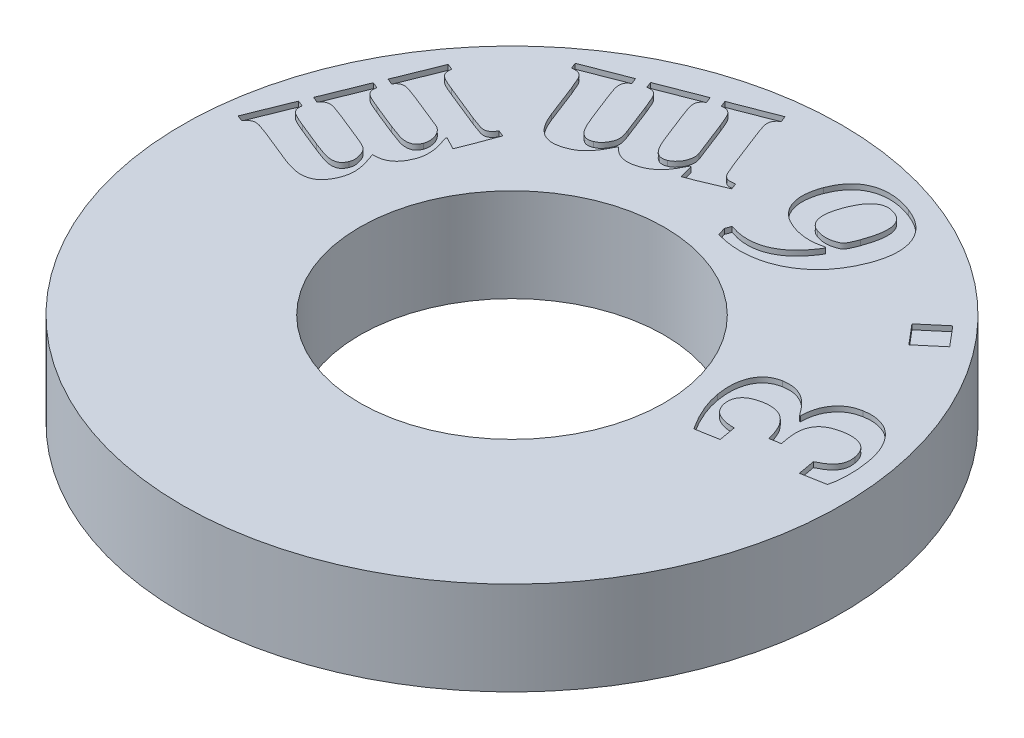
from build123d import *

# Parameters (mm, degrees)
SKETCH1_R           = 12.7
BOSS_EXTRUDE1_DEPTH = 3.6
SKETCH2_R           = 5.8674
CUT_EXTRUDE1_DEPTH  = 19.317750954
CUT_EXTRUDE2_DEPTH  = 0.2


with BuildPart() as part:
    # Sketch1 → Boss-Extrude1 (new body)
    with BuildSketch(Plane(origin=(0, 0, 0), x_dir=(1, 0, 0), z_dir=(0, 1, 0))):
        with Locations(Location((0, 0, 0), (0, 0, 270))):
            Circle(SKETCH1_R)
    extrude(amount=BOSS_EXTRUDE1_DEPTH)

    # Sketch2 → Cut-Extrude1 (cut, through all)
    with BuildSketch(Plane(origin=(0, 0, 0), x_dir=(-1, 0, 0), z_dir=(0, -1, 0))):
        with Locations(Location((0, 0, 0), (0, 0, 90))):
            Circle(SKETCH2_R)
    extrude(amount=-CUT_EXTRUDE1_DEPTH, mode=Mode.SUBTRACT)

    # Sketch4 → Cut-Extrude2 (cut)
    # profile 1 of 5: a face of its own
    with BuildSketch(Plane(origin=(0, 3.6, 0), x_dir=(1, 0, 0), z_dir=(0, 1, 0))):
        with BuildLine():
            Line((8.164580493, -0.141111111), (7.299172507, -0.294348958))
            add(Edge.make_bspline(
                [(7.299172507, -0.294348958), (7.254126865, -0.224151115), (7.165775959, -0.086467583), (7.045489583, 0.122458288), (6.938429156, 0.327907963), (6.845588657, 0.530877084), (6.764550442, 0.729493953), (6.698650802, 0.925985441), (6.643082808, 1.118355277), (6.618049918, 1.247367299), (6.605743687, 1.310789931)],
                knots=[0, 0, 0, 0, 1.137107975, 2.23028277, 3.285789175, 4.29468346, 5.272556553, 6.20897527, 7.119527785, 8, 8, 8, 8], degree=3))
            add(Edge.make_bspline(
                [(6.605743687, 1.310789931), (6.594270562, 1.38377459), (6.571928431, 1.525900877), (6.558947636, 1.736162087), (6.562833216, 1.936093162), (6.58410888, 2.125025368), (6.624243067, 2.300223785), (6.682765182, 2.45978553), (6.758962892, 2.602442887), (6.853390282, 2.727545195), (6.965656947, 2.833485564), (7.09561771, 2.918642555), (7.242991414, 2.981053957), (7.348665157, 3.004327267), (7.402800979, 3.01625)],
                knots=[0, 0, 0, 0, 1.257534887, 2.448853862, 3.581761746, 4.659110775, 5.680658369, 6.634983106, 7.544925383, 8.424762642, 9.292432414, 10.160237565, 11.057504272, 12, 12, 12, 12], degree=3))
            add(Edge.make_bspline(
                [(7.402800979, 3.01625), (7.453401354, 3.02362584), (7.551680605, 3.037951664), (7.69794884, 3.040231883), (7.837573421, 3.024901552), (7.971110699, 2.992446158), (8.098362087, 2.944895478), (8.219666965, 2.882100332), (8.335895968, 2.805882639), (8.447266456, 2.713606621), (8.556444324, 2.606194026), (8.668901434, 2.484744861), (8.780212806, 2.344232093), (8.853239027, 2.243719149), (8.891082229, 2.191631944)],
                knots=[0, 0, 0, 0, 1.013739218, 1.968948484, 2.893245571, 3.793330219, 4.688470041, 5.581915844, 6.497952119, 7.440811012, 8.446231258, 9.53500789, 10.72260683, 12, 12, 12, 12], degree=3))
            Line((8.891082229, 2.191631944), (8.924155146, 2.198246528))
            add(Edge.make_bspline(
                [(8.924155146, 2.198246528), (8.924918634, 2.251967384), (8.926430196, 2.358324536), (8.947473771, 2.515402809), (8.979674955, 2.668205104), (9.028264793, 2.815080237), (9.091963081, 2.953896093), (9.170838403, 3.083595629), (9.266021551, 3.201490829), (9.375901049, 3.308259942), (9.500439904, 3.401525353), (9.641028101, 3.476619078), (9.795253083, 3.534806257), (9.904558779, 3.557876025), (9.960439868, 3.569670139)],
                knots=[0, 0, 0, 0, 1.026335185, 2.031949896, 3.024124183, 4.008331677, 4.982837344, 5.938341286, 6.902791705, 7.871633439, 8.860843291, 9.866752457, 10.909405448, 12, 12, 12, 12], degree=3))
            add(Edge.make_bspline(
                [(9.960439868, 3.569670139), (10.02973183, 3.579810447), (10.165317884, 3.59965235), (10.368599346, 3.594073048), (10.564481426, 3.562117282), (10.721811743, 3.512715037), (10.841751206, 3.458209336), (10.929302634, 3.411216165), (11.012460066, 3.355066353), (11.093066227, 3.292408771), (11.170330286, 3.221492934), (11.244348579, 3.142988141), (11.31460909, 3.056826737), (11.382174158, 2.963848054), (11.446012474, 2.864003809), (11.504277471, 2.757036048), (11.557126893, 2.64330511), (11.607411674, 2.523988889), (11.649279477, 2.396241197), (11.689640871, 2.263161114), (11.723823342, 2.122933348), (11.741692043, 2.026728187), (11.75078709, 1.977760417)],
                knots=[0, 0, 0, 0, 1.552055264, 3.036961932, 4.491926841, 5.946868886, 6.680668832, 7.414332759, 8.149582009, 8.905049753, 9.678705273, 10.474991778, 11.297986015, 12.144768462, 13.024991339, 13.926610153, 14.846130849, 15.808017766, 16.798530401, 17.828267102, 18.894602771, 20, 20, 20, 20], degree=3))
            add(Edge.make_bspline(
                [(11.75078709, 1.977760417), (11.762170129, 1.909141634), (11.784865898, 1.772327898), (11.805834162, 1.566157462), (11.820237717, 1.360255663), (11.821432039, 1.156401104), (11.815751139, 0.958057912), (11.799090489, 0.769266598), (11.773822813, 0.591512389), (11.74718336, 0.478296539), (11.734250632, 0.423333333)],
                knots=[0, 0, 0, 0, 1.066248548, 2.125911334, 3.176109364, 4.22982333, 5.250230149, 6.217431478, 7.134611624, 8, 8, 8, 8], degree=3))
            Line((11.734250632, 0.423333333), (10.81702841, 0.260173611))
            Line((10.81702841, 0.260173611), (10.700170771, 0.917222222))
            add(Edge.make_bspline(
                [(10.700170771, 0.917222222), (10.762179027, 0.947249342), (10.87880441, 1.003724473), (11.034174858, 1.101751404), (11.158720401, 1.206462209), (11.253775922, 1.319041601), (11.319999677, 1.441297519), (11.357555629, 1.573998106), (11.369098331, 1.717631478), (11.355492256, 1.8147095), (11.348399937, 1.8653125)],
                knots=[0, 0, 0, 0, 1.315010116, 2.473276457, 3.498567572, 4.410559322, 5.270838744, 6.132605253, 7.026599701, 8, 8, 8, 8], degree=3))
            add(Edge.make_bspline(
                [(11.348399937, 1.8653125), (11.341875398, 1.896288119), (11.329168234, 1.956616093), (11.303022935, 2.042880304), (11.269570612, 2.121812102), (11.230594454, 2.193837832), (11.183135666, 2.256957094), (11.131530054, 2.314555266), (11.071096113, 2.362472217), (11.00586727, 2.405220266), (10.933755742, 2.439162109), (10.855303799, 2.465778349), (10.770761853, 2.485449867), (10.67922078, 2.497494268), (10.581482565, 2.501671969), (10.477666576, 2.497756593), (10.36751511, 2.48816074), (10.292571495, 2.47583813), (10.253686396, 2.469444444)],
                knots=[0, 0, 0, 0, 1.062681572, 2.069673814, 3.020757619, 3.937606762, 4.811257529, 5.667036378, 6.526543355, 7.392491981, 8.281089848, 9.194194867, 10.169932879, 11.190815326, 12.290117787, 13.450598505, 14.67722244, 16, 16, 16, 16], degree=3))
            add(Edge.make_bspline(
                [(10.253686396, 2.469444444), (10.21236047, 2.46132416), (10.131880827, 2.445510415), (10.017411818, 2.410878653), (9.912269196, 2.370828699), (9.817507825, 2.322327855), (9.730958567, 2.269412482), (9.655575618, 2.206825721), (9.589554436, 2.137741036), (9.533205575, 2.061467789), (9.486328214, 1.977858623), (9.449830602, 1.88666702), (9.423879767, 1.788072069), (9.406187836, 1.682170703), (9.397512474, 1.568922063), (9.398928891, 1.448354811), (9.410343924, 1.320580603), (9.424126681, 1.23354771), (9.431273201, 1.188420139)],
                knots=[0, 0, 0, 0, 1.154959404, 2.249210876, 3.277206245, 4.237710271, 5.166517796, 6.054758483, 6.917744217, 7.78290676, 8.649654335, 9.540923156, 10.470387237, 11.441785199, 12.483486141, 13.582604788, 14.746552339, 16, 16, 16, 16], degree=3))
            Line((9.431273201, 1.188420139), (9.481985007, 0.900685764))
            Line((9.481985007, 0.900685764), (9.065266257, 0.826822917))
            add(Edge.make_bspline(
                [(9.065266257, 0.826822917), (9.053323817, 0.877676496), (9.030137799, 0.976407744), (8.987244973, 1.117988979), (8.937533381, 1.248770458), (8.881792532, 1.368690848), (8.819830871, 1.477481839), (8.752229286, 1.575466019), (8.678817317, 1.662719018), (8.598729466, 1.738292833), (8.513214815, 1.803047835), (8.421509279, 1.856340144), (8.323475539, 1.896941453), (8.220208249, 1.927841187), (8.110287748, 1.942901187), (7.995250364, 1.950152445), (7.874369093, 1.944561747), (7.792962145, 1.931532679), (7.751169035, 1.92484375)],
                knots=[0, 0, 0, 0, 1.29334587, 2.511006204, 3.66023295, 4.755331661, 5.78245763, 6.75683239, 7.69945718, 8.600673867, 9.477910914, 10.350415315, 11.219115034, 12.100354848, 13.011532052, 13.959500513, 14.952438064, 16, 16, 16, 16], degree=3))
            add(Edge.make_bspline(
                [(7.751169035, 1.92484375), (7.718361479, 1.918684397), (7.654878827, 1.906766043), (7.56449535, 1.882070779), (7.481027571, 1.854805546), (7.404677013, 1.822802045), (7.334829516, 1.786487271), (7.272164335, 1.74578084), (7.216101005, 1.701748524), (7.168731337, 1.652587746), (7.127375298, 1.600945568), (7.093993557, 1.544819854), (7.06728175, 1.485362703), (7.048847784, 1.421835625), (7.036374118, 1.355396311), (7.032194914, 1.285454635), (7.035753428, 1.211992754), (7.042982253, 1.16228153), (7.04671591, 1.136605903)],
                knots=[0, 0, 0, 0, 1.330790509, 2.575080919, 3.733736543, 4.830684231, 5.873010726, 6.868969425, 7.807408956, 8.709078305, 9.585745051, 10.440327213, 11.306394197, 12.178146853, 13.072160606, 13.997345489, 14.965637813, 16, 16, 16, 16], degree=3))
            add(Edge.make_bspline(
                [(7.04671591, 1.136605903), (7.053004764, 1.107385859), (7.065390456, 1.04983794), (7.095730836, 0.96773557), (7.134678797, 0.890623747), (7.18316375, 0.818478839), (7.243733132, 0.751860879), (7.318753902, 0.693659581), (7.406941065, 0.641629631), (7.508842162, 0.596349572), (7.624681245, 0.560613729), (7.753820566, 0.534008848), (7.896341682, 0.519118617), (7.995874441, 0.51702704), (8.047722854, 0.5159375)],
                knots=[0, 0, 0, 0, 0.831011314, 1.636649549, 2.42794293, 3.230719671, 4.048727296, 4.922444941, 5.862595765, 6.892733277, 8.018408123, 9.229923594, 10.557017127, 12, 12, 12, 12], degree=3))
            Line((8.047722854, 0.5159375), (8.164580493, -0.141111111))
        make_face()
    # profile 2 of 5: a face of its own
    with BuildSketch(Plane(origin=(0, 3.6, 0), x_dir=(1, 0, 0), z_dir=(0, 1, 0))):
        Polygon((7.998334498, 7.413598887), (8.851615748, 8.134588471), (9.493230331, 7.375013818), (8.639949081, 6.654024235), align=None)
    # profile 3 of 5: a face of its own
    with BuildSketch(Plane(origin=(0, 3.6, 0), x_dir=(1, 0, 0), z_dir=(0, 1, 0))):
        with BuildLine():
            Line((1.200452366, 6.983777969), (1.280929797, 7.199854358))
            add(Edge.make_bspline(
                [(1.280929797, 7.199854358), (1.343817795, 7.179261353), (1.467155686, 7.138873713), (1.654011169, 7.098413309), (1.836977253, 7.07493453), (2.015597423, 7.068035969), (2.190562747, 7.078072145), (2.361694864, 7.104178741), (2.529159758, 7.148459834), (2.691452106, 7.211129672), (2.849876645, 7.288087424), (3.00262888, 7.382899312), (3.150358517, 7.492976917), (3.291751018, 7.620066885), (3.42880272, 7.760899591), (3.558935253, 7.919039208), (3.685331048, 8.091932582), (3.761884595, 8.216465585), (3.801086047, 8.280236302)],
                knots=[0, 0, 0, 0, 1.055048788, 2.0691944, 3.044229261, 3.994526873, 4.916374231, 5.835814113, 6.751508959, 7.673635849, 8.606948974, 9.557047682, 10.537179467, 11.541963796, 12.586653235, 13.668953384, 14.806320344, 16, 16, 16, 16], degree=3))
            Line((3.801086047, 8.280236302), (3.770217991, 8.307797066))
            add(Edge.make_bspline(
                [(3.770217991, 8.307797066), (3.71414798, 8.294562398), (3.604496336, 8.268680414), (3.440218512, 8.243045281), (3.280238818, 8.230703616), (3.12312468, 8.231653016), (2.966792107, 8.24638583), (2.809094217, 8.274242223), (2.648638057, 8.314787763), (2.542955388, 8.351804744), (2.489193686, 8.370635608)],
                knots=[0, 0, 0, 0, 1.05963004, 2.072233846, 3.055361679, 4.0086536, 4.959232627, 5.940685308, 6.95240852, 8, 8, 8, 8], degree=3))
            add(Edge.make_bspline(
                [(2.489193686, 8.370635608), (2.425678851, 8.396737335), (2.302249784, 8.447461105), (2.132920474, 8.545831273), (1.986886121, 8.662813599), (1.863257967, 8.795473288), (1.764751057, 8.943805026), (1.688468588, 9.103519705), (1.639308535, 9.275732636), (1.612688242, 9.457753868), (1.611225732, 9.648604645), (1.633351871, 9.846131474), (1.675600618, 10.050562667), (1.722178032, 10.185318726), (1.746155491, 10.254689427)],
                knots=[0, 0, 0, 0, 1.077595584, 2.094103196, 3.062986482, 4.006354381, 4.929902502, 5.848931818, 6.774838988, 7.731371815, 8.729829957, 9.762912156, 10.848375697, 12, 12, 12, 12], degree=3))
            add(Edge.make_bspline(
                [(1.746155491, 10.254689427), (1.7763527, 10.329017713), (1.835212514, 10.473896968), (1.951299256, 10.672660048), (2.085665588, 10.848945539), (2.213804547, 10.97741434), (2.326332688, 11.065860187), (2.414590439, 11.126148678), (2.508811454, 11.177493313), (2.606907441, 11.223070875), (2.710126865, 11.260830416), (2.818355474, 11.290046763), (2.930920772, 11.313549546), (3.048111242, 11.328816613), (3.169265694, 11.336319095), (3.294130713, 11.336644782), (3.422555278, 11.327106532), (3.55443731, 11.311041992), (3.689828281, 11.285147679), (3.828062677, 11.250881114), (3.970010998, 11.208775039), (4.064699677, 11.175620405), (4.113073894, 11.158682483)],
                knots=[0, 0, 0, 0, 1.672877526, 3.260740491, 4.787171376, 6.289516588, 7.032212332, 7.772527889, 8.517517252, 9.269110702, 10.028607479, 10.808285605, 11.607046719, 12.427139982, 13.272559756, 14.139283271, 15.03113053, 15.958707747, 16.910946222, 17.906201506, 18.93032764, 20, 20, 20, 20], degree=3))
            add(Edge.make_bspline(
                [(4.113073894, 11.158682483), (4.15697111, 11.141450954), (4.243422618, 11.107515052), (4.368170705, 11.050419534), (4.484996173, 10.987386071), (4.59493391, 10.920003123), (4.697245283, 10.847353308), (4.79277647, 10.769806838), (4.880831456, 10.687287685), (4.961582993, 10.600024174), (5.034609675, 10.508303615), (5.099779246, 10.41208411), (5.157520331, 10.31176066), (5.205939239, 10.20638206), (5.246771826, 10.09693552), (5.280219809, 9.983207721), (5.303980564, 9.864730901), (5.320880501, 9.742517717), (5.328043678, 9.616488704), (5.328305305, 9.48689334), (5.319416583, 9.353933132), (5.301199014, 9.21787529), (5.276088854, 9.078654194), (5.241524935, 8.936320611), (5.198718022, 8.790527437), (5.163826853, 8.693479882), (5.146051325, 8.644038385)],
                knots=[0, 0, 0, 0, 1.098191461, 2.162786548, 3.192832132, 4.188048845, 5.164054587, 6.113082797, 7.051594597, 7.972179555, 8.879742853, 9.779402692, 10.67641257, 11.572442019, 12.476973698, 13.395128669, 14.330043427, 15.288670823, 16.266176383, 17.267519822, 18.30535816, 19.36692158, 20.463110258, 21.598586896, 22.776584751, 24, 24, 24, 24], degree=3))
            add(Edge.make_bspline(
                [(5.146051325, 8.644038385), (5.120410458, 8.577547881), (5.069504659, 8.445541726), (4.979642143, 8.255748764), (4.882591907, 8.073477), (4.7757546, 7.901071263), (4.66050112, 7.736651354), (4.536347737, 7.581334242), (4.401952184, 7.435476143), (4.260695193, 7.298015339), (4.111468893, 7.171081941), (3.956153925, 7.054726669), (3.793202875, 6.951568523), (3.625965791, 6.857262903), (3.452169721, 6.775166977), (3.271848517, 6.706482366), (3.086418619, 6.645984938), (2.895066533, 6.599208672), (2.700286371, 6.564048118), (2.50372428, 6.540540621), (2.305560774, 6.530620344), (2.106360141, 6.534210416), (1.905755587, 6.549850704), (1.704278713, 6.57711169), (1.501495309, 6.618153508), (1.367468793, 6.65450437), (1.299671116, 6.672892552)],
                knots=[0, 0, 0, 0, 1.070823632, 2.125947334, 3.153976389, 4.173332704, 5.172465224, 6.170528418, 7.159609897, 8.15178657, 9.131336938, 10.102378564, 11.066150857, 12.028085339, 12.986779263, 13.952022445, 14.926733186, 15.916739616, 16.91025301, 17.90025944, 18.890219644, 19.890115268, 20.892859756, 21.913053768, 22.944312598, 24, 24, 24, 24], degree=3))
            Line((1.299671116, 6.672892552), (1.200452366, 6.983777969))
        make_face()
        with BuildLine():
            add(Edge.make_bspline(
                [(3.076789172, 8.698057483), (3.132909456, 8.679932439), (3.243010075, 8.644373488), (3.413032857, 8.625283629), (3.576075832, 8.63331494), (3.704133547, 8.658205157), (3.795432605, 8.686357261), (3.852529709, 8.707316756), (3.898519111, 8.728016151), (3.948692476, 8.75488002), (4.001805532, 8.805818747), (4.047266948, 8.872729684), (4.084461884, 8.946478634), (4.119923668, 9.023856133), (4.158569665, 9.121872517), (4.186258552, 9.19376456), (4.201268339, 9.232736302)],
                knots=[0, 0, 0, 0, 1.710541778, 3.355858038, 4.938271646, 6.440062148, 7.13262002, 7.713873542, 8.206199276, 8.598318393, 9.361997601, 10.313061428, 10.938824559, 11.760841173, 12.786181087, 14, 14, 14, 14], degree=3))
            add(Edge.make_bspline(
                [(4.201268339, 9.232736302), (4.219616657, 9.284432015), (4.255072374, 9.384327197), (4.30105685, 9.531510269), (4.335960436, 9.671161482), (4.362974871, 9.803145166), (4.381080853, 9.927152769), (4.388903885, 10.043638718), (4.388039482, 10.152006568), (4.378848483, 10.252989558), (4.358648581, 10.346021304), (4.330820471, 10.43180026), (4.290949714, 10.508625418), (4.24422561, 10.579514316), (4.184064175, 10.639885789), (4.116891173, 10.694879513), (4.038769365, 10.7401109), (3.982187335, 10.763211055), (3.953221464, 10.775036649)],
                knots=[0, 0, 0, 0, 1.500894568, 2.900281813, 4.217152542, 5.437764563, 6.585289063, 7.643385764, 8.628806701, 9.548256839, 10.412033135, 11.229197673, 12.007129352, 12.774066827, 13.542058149, 14.328777375, 15.144455933, 16, 16, 16, 16], degree=3))
            add(Edge.make_bspline(
                [(3.953221464, 10.775036649), (3.919245977, 10.786364872), (3.853943728, 10.80813817), (3.75608292, 10.828911875), (3.662442482, 10.834694319), (3.573482634, 10.826592591), (3.488865702, 10.807977138), (3.408458099, 10.777657234), (3.332269753, 10.736631897), (3.260047544, 10.685155263), (3.191439608, 10.624053207), (3.126309215, 10.552989981), (3.064446481, 10.472120724), (2.985796284, 10.348662157), (2.892809985, 10.174619164), (2.834135004, 10.024617309), (2.803386394, 9.946008871)],
                knots=[0, 0, 0, 0, 0.932873925, 1.793021151, 2.598839487, 3.367856657, 4.113627244, 4.849993345, 5.599749579, 6.36230028, 7.155964143, 7.989527263, 8.87058289, 9.805567893, 11.801908814, 14, 14, 14, 14], degree=3))
            add(Edge.make_bspline(
                [(2.803386394, 9.946008871), (2.789021343, 9.905717802), (2.761142699, 9.82752383), (2.727163126, 9.711565588), (2.69985937, 9.601384176), (2.682829992, 9.496212874), (2.670852833, 9.39695612), (2.668292805, 9.303160591), (2.675472645, 9.215066626), (2.688060026, 9.132630092), (2.708521729, 9.055609287), (2.739278462, 8.985918652), (2.775041981, 8.920834938), (2.820963864, 8.863655968), (2.873499986, 8.812178352), (2.933526127, 8.766434912), (3.002012742, 8.728007435), (3.051553194, 8.708165164), (3.076789172, 8.698057483)],
                knots=[0, 0, 0, 0, 1.424088551, 2.763767271, 4.022183305, 5.201039714, 6.30911801, 7.349523498, 8.319005133, 9.248428938, 10.124185317, 10.962911168, 11.779474492, 12.589779123, 13.394520957, 14.224182145, 15.095395788, 16, 16, 16, 16], degree=3))
        make_face(mode=Mode.SUBTRACT)
    # profile 4 of 5: a face of its own
    with BuildSketch(Plane(origin=(0, 3.6, 0), x_dir=(1, 0, 0), z_dir=(0, 1, 0))):
        with BuildLine():
            Line((-1.500499582, 8.398806621), (-1.545699235, 8.394396899))
            add(Edge.make_bspline(
                [(-1.545699235, 8.394396899), (-1.578680129, 8.328177935), (-1.64156419, 8.201919461), (-1.744030648, 8.02884167), (-1.846044886, 7.880084841), (-1.949946333, 7.754727011), (-2.05857315, 7.650318657), (-2.17357881, 7.562688436), (-2.294646542, 7.48709386), (-2.38188138, 7.450331118), (-2.425438818, 7.431975024)],
                knots=[0, 0, 0, 0, 1.327248858, 2.530640849, 3.606312378, 4.561298934, 5.447501221, 6.30354898, 7.15294094, 8, 8, 8, 8], degree=3))
            add(Edge.make_bspline(
                [(-2.425438818, 7.431975024), (-2.466711164, 7.416501822), (-2.546064862, 7.386751738), (-2.664025189, 7.356362389), (-2.774202536, 7.336715383), (-2.877415506, 7.329477021), (-2.975012839, 7.335492968), (-3.068194376, 7.350780271), (-3.158059284, 7.376341345), (-3.244768044, 7.411813357), (-3.328951411, 7.458526601), (-3.408552551, 7.519497131), (-3.489562903, 7.588502591), (-3.538054885, 7.643001758), (-3.563147151, 7.671202454)],
                knots=[0, 0, 0, 0, 1.261849166, 2.426137807, 3.483538902, 4.464561663, 5.381899843, 6.278343648, 7.164718223, 8.052217243, 8.957088943, 9.91293841, 10.920046081, 12, 12, 12, 12], degree=3))
            add(Edge.make_bspline(
                [(-3.563147151, 7.671202454), (-3.599531182, 7.59843004), (-3.668389116, 7.460705936), (-3.777147706, 7.27123298), (-3.885029972, 7.111206789), (-3.99057811, 6.976050247), (-4.102053829, 6.86480688), (-4.219976724, 6.770641123), (-4.348199055, 6.69203994), (-4.439779694, 6.652578048), (-4.485881526, 6.632712871)],
                knots=[0, 0, 0, 0, 1.370148351, 2.593049264, 3.676206861, 4.618613109, 5.476374145, 6.322127868, 7.155356622, 8, 8, 8, 8], degree=3))
            add(Edge.make_bspline(
                [(-4.485881526, 6.632712871), (-4.530445251, 6.616076964), (-4.615952839, 6.584156465), (-4.743101562, 6.551526654), (-4.861772979, 6.530294812), (-4.973189572, 6.524827778), (-5.078684173, 6.531644554), (-5.178538203, 6.555233414), (-5.275449977, 6.587065021), (-5.366578661, 6.635862424), (-5.452894115, 6.696968271), (-5.534744327, 6.770753064), (-5.613569564, 6.855921676), (-5.687290851, 6.95508305), (-5.757960734, 7.067347228), (-5.826043906, 7.19293182), (-5.891036555, 7.332819596), (-5.93122393, 7.431428083), (-5.952114165, 7.482686829)],
                knots=[0, 0, 0, 0, 1.164238848, 2.233907847, 3.210467445, 4.111618036, 4.95998529, 5.789768502, 6.618037198, 7.451375979, 8.310370773, 9.20280479, 10.145472204, 11.148103074, 12.224265042, 13.392220349, 14.64442181, 16, 16, 16, 16], degree=3))
            Line((-5.952114165, 7.482686829), (-6.443798193, 8.752686829))
            add(Edge.make_bspline(
                [(-6.443798193, 8.752686829), (-6.46298886, 8.80204742), (-6.500138469, 8.897600464), (-6.557518406, 9.031550001), (-6.610596713, 9.14701544), (-6.6652213, 9.236719574), (-6.719195792, 9.30301382), (-6.776882541, 9.349899558), (-6.841998121, 9.381410269), (-6.91741995, 9.396764093), (-7.003583166, 9.400735532), (-7.06413052, 9.395102303), (-7.096437082, 9.392096552)],
                knots=[0, 0, 0, 0, 1.559140996, 3.018210822, 4.290952874, 5.296787436, 6.103062558, 6.795868098, 7.468525882, 8.211398264, 9.045646607, 10, 10, 10, 10], degree=3))
            Line((-7.096437082, 9.392096552), (-7.185733957, 9.621402107))
            Line((-7.185733957, 9.621402107), (-5.508937082, 10.271836135))
            Line((-5.508937082, 10.271836135), (-5.419640207, 10.042530579))
            add(Edge.make_bspline(
                [(-5.419640207, 10.042530579), (-5.44126826, 10.026399982), (-5.481650493, 9.996282175), (-5.533846741, 9.947929725), (-5.570951767, 9.898212078), (-5.594627254, 9.847372575), (-5.604920024, 9.794555745), (-5.609329846, 9.738344691), (-5.607052869, 9.676900081), (-5.596124222, 9.607106489), (-5.574701737, 9.523170129), (-5.540686924, 9.418742082), (-5.495430219, 9.289738424), (-5.459929128, 9.196145913), (-5.440586387, 9.145152107)],
                knots=[0, 0, 0, 0, 0.976263073, 1.822803084, 2.564919562, 3.207680077, 3.833713685, 4.500778585, 5.245986733, 6.052842077, 7.052732165, 8.377616694, 10.026347317, 12, 12, 12, 12], degree=3))
            Line((-5.440586387, 9.145152107), (-5.077886735, 8.212495857))
            add(Edge.make_bspline(
                [(-5.077886735, 8.212495857), (-5.058213378, 8.162818328), (-5.020773209, 8.068277516), (-4.964958774, 7.935032266), (-4.911566849, 7.817607376), (-4.862407323, 7.714442109), (-4.814206633, 7.625009471), (-4.764214553, 7.549826783), (-4.714948421, 7.485912263), (-4.663879121, 7.434812521), (-4.612373766, 7.394089192), (-4.560879865, 7.363706829), (-4.510177119, 7.340304693), (-4.45834347, 7.326789669), (-4.404290481, 7.322415505), (-4.347102358, 7.327322637), (-4.286499427, 7.340839251), (-4.245784961, 7.355102318), (-4.224605485, 7.362521899)],
                knots=[0, 0, 0, 0, 1.886072366, 3.589365554, 5.098767554, 6.438935382, 7.62327005, 8.680997452, 9.623029443, 10.466885591, 11.224590498, 11.934248244, 12.573028465, 13.189694188, 13.814492117, 14.478078476, 15.208303495, 16, 16, 16, 16], degree=3))
            add(Edge.make_bspline(
                [(-4.224605485, 7.362521899), (-4.196124879, 7.375107043), (-4.140617846, 7.399634753), (-4.06647594, 7.453951996), (-4.002096369, 7.521299194), (-3.946506985, 7.600529328), (-3.897145713, 7.683379182), (-3.857845601, 7.766968153), (-3.829112457, 7.850147785), (-3.819086508, 7.936966256), (-3.820853325, 8.026934807), (-3.836167036, 8.105507556), (-3.855045624, 8.176985637), (-3.877649694, 8.244743013), (-3.906253353, 8.326857924), (-3.92895999, 8.385647919), (-3.941280832, 8.41754794)],
                knots=[0, 0, 0, 0, 1.05712718, 2.060278967, 3.103930472, 4.214663213, 5.347149753, 6.382223774, 7.355140304, 8.326206341, 9.339519046, 10.406659634, 11.040664636, 11.855394827, 12.836316401, 14, 14, 14, 14], degree=3))
            Line((-3.941280832, 8.41754794), (-4.381150624, 9.551948982))
            add(Edge.make_bspline(
                [(-4.381150624, 9.551948982), (-4.395843684, 9.589066049), (-4.42322045, 9.65822422), (-4.461713942, 9.755215287), (-4.496936471, 9.837422587), (-4.535923805, 9.924848545), (-4.581174005, 10.013011645), (-4.639853073, 10.097027896), (-4.70584835, 10.158300648), (-4.770957186, 10.189348355), (-4.82925529, 10.203846904), (-4.881158179, 10.209027832), (-4.940539071, 10.208514609), (-4.982726237, 10.205229651), (-5.005126318, 10.20348544)],
                knots=[0, 0, 0, 0, 1.43593228, 2.675492938, 3.753329024, 4.652559938, 6.11901344, 7.311444819, 8.322447917, 9.321542641, 9.866545793, 10.478167495, 11.191953967, 12, 12, 12, 12], degree=3))
            Line((-5.005126318, 10.20348544), (-5.094423193, 10.432790996))
            Line((-5.094423193, 10.432790996), (-3.438572499, 11.074405579))
            Line((-3.438572499, 11.074405579), (-3.349275624, 10.845100024))
            add(Edge.make_bspline(
                [(-3.349275624, 10.845100024), (-3.371829284, 10.829185098), (-3.413734166, 10.799615038), (-3.465251913, 10.749034653), (-3.503876703, 10.69980329), (-3.528520914, 10.648919497), (-3.540482433, 10.595811986), (-3.544340482, 10.539416273), (-3.542185737, 10.47838512), (-3.531505961, 10.409501208), (-3.508063178, 10.326746257), (-3.474739068, 10.222065038), (-3.429638126, 10.092106636), (-3.393324208, 9.997946719), (-3.373529096, 9.946619121)],
                knots=[0, 0, 0, 0, 0.992957471, 1.844922954, 2.591631667, 3.237113429, 3.86329802, 4.54058269, 5.269232777, 6.059395145, 7.045266299, 8.364235463, 10.018105088, 12, 12, 12, 12], degree=3))
            Line((-3.373529096, 9.946619121), (-3.010829443, 9.013962871))
            add(Edge.make_bspline(
                [(-3.010829443, 9.013962871), (-2.996657788, 8.977151092), (-2.969516159, 8.906648973), (-2.928004225, 8.806398578), (-2.891454916, 8.714556702), (-2.844654724, 8.610739499), (-2.791764113, 8.500780224), (-2.730333993, 8.390242101), (-2.666711658, 8.305624809), (-2.604799685, 8.236574129), (-2.538315851, 8.186697449), (-2.473039115, 8.148601797), (-2.403922676, 8.128561555), (-2.329787806, 8.121444181), (-2.246708712, 8.132336889), (-2.1910254, 8.152150967), (-2.160855485, 8.162886482)],
                knots=[0, 0, 0, 0, 1.218376668, 2.33344156, 3.351562828, 4.271279059, 5.850097088, 7.121466675, 8.168044415, 9.115705124, 9.973893436, 10.725810247, 11.436861629, 12.177817345, 13.012718608, 14, 14, 14, 14], degree=3))
            add(Edge.make_bspline(
                [(-2.160855485, 8.162886482), (-2.139651487, 8.17267279), (-2.096037015, 8.192802233), (-2.034047516, 8.233544001), (-1.97680789, 8.28717359), (-1.920611109, 8.347803533), (-1.870920225, 8.417558281), (-1.828079155, 8.49341736), (-1.795216046, 8.575437602), (-1.771331247, 8.661942034), (-1.756280888, 8.749896331), (-1.755281747, 8.83758026), (-1.766801807, 8.92340652), (-1.78547311, 8.977820506), (-1.79484854, 9.005143427)],
                knots=[0, 0, 0, 0, 0.836243377, 1.720067758, 2.64304706, 3.640427864, 4.67827718, 5.704026804, 6.755486752, 7.835339964, 8.915594534, 9.942780013, 10.967007125, 12, 12, 12, 12], degree=3))
            Line((-1.79484854, 9.005143427), (-2.317400624, 10.352313565))
            add(Edge.make_bspline(
                [(-2.317400624, 10.352313565), (-2.337449883, 10.40272207), (-2.374297839, 10.495366407), (-2.426816724, 10.620893065), (-2.471793057, 10.720796935), (-2.510807835, 10.798084427), (-2.54947846, 10.857414013), (-2.587241421, 10.906814316), (-2.629873376, 10.945553523), (-2.675175925, 10.977219168), (-2.728120542, 10.998709343), (-2.789785301, 11.010093904), (-2.861054931, 11.0134522), (-2.911278956, 11.00790917), (-2.938069026, 11.004952454)],
                knots=[0, 0, 0, 0, 1.95560344, 3.594147164, 4.904245662, 5.905587673, 6.710271926, 7.455046029, 8.139409163, 8.778697916, 9.437986146, 10.180991047, 11.02971977, 12, 12, 12, 12], degree=3))
            Line((-2.938069026, 11.004952454), (-3.027365901, 11.23425801))
            Line((-3.027365901, 11.23425801), (-1.360490901, 11.880282315))
            Line((-1.360490901, 11.880282315), (-1.271194026, 11.65097676))
            add(Edge.make_bspline(
                [(-1.271194026, 11.65097676), (-1.294464177, 11.633544837), (-1.337723243, 11.601139), (-1.391337788, 11.547318124), (-1.431986317, 11.49598486), (-1.45922466, 11.443955182), (-1.473163029, 11.3904295), (-1.479948266, 11.334042404), (-1.478351478, 11.2732882), (-1.469043519, 11.204391579), (-1.446753676, 11.121913989), (-1.414774149, 11.018105936), (-1.368617134, 10.890236847), (-1.333428141, 10.796908086), (-1.314188818, 10.745881274)],
                knots=[0, 0, 0, 0, 1.037135948, 1.928029266, 2.705015774, 3.368269828, 4.008263075, 4.669175765, 5.391120458, 6.172527977, 7.146544743, 8.437585155, 10.052275959, 12, 12, 12, 12], degree=3))
            Line((-1.314188818, 10.745881274), (-0.759666249, 9.316028843))
            add(Edge.make_bspline(
                [(-0.759666249, 9.316028843), (-0.743921112, 9.275951927), (-0.714551879, 9.201196888), (-0.672985784, 9.097792191), (-0.636647661, 9.011772902), (-0.597587967, 8.923591054), (-0.551084166, 8.837162329), (-0.490114353, 8.754815403), (-0.417614899, 8.699473063), (-0.347881536, 8.672373402), (-0.282522669, 8.66399496), (-0.221567487, 8.665129956), (-0.1486079, 8.670552639), (-0.096688113, 8.678765615), (-0.06844229, 8.683233704)],
                knots=[0, 0, 0, 0, 1.450579982, 2.705751189, 3.754223165, 4.596399602, 5.953928095, 7.055990142, 8.019135306, 8.987042258, 9.536785458, 10.230042737, 11.037093544, 12, 12, 12, 12], degree=3))
            Line((-0.06844229, 8.683233704), (0.023059446, 8.446211135))
            Line((0.023059446, 8.446211135), (-0.919518679, 8.048233704))
            Line((-0.919518679, 8.048233704), (-1.35828604, 7.878459399))
            Line((-1.35828604, 7.878459399), (-1.500499582, 8.398806621))
        make_face()
    # profile 5 of 5: a face of its own
    with BuildSketch(Plane(origin=(0, 3.6, 0), x_dir=(1, 0, 0), z_dir=(0, 1, 0))):
        with BuildLine():
            Line((-7.16368149, 4.664663168), (-7.190139823, 4.626078099))
            add(Edge.make_bspline(
                [(-7.190139823, 4.626078099), (-7.164649314, 4.55729115), (-7.116159018, 4.42643855), (-7.060406274, 4.234988301), (-7.023567353, 4.059884896), (-7.00352064, 3.899037183), (-7.001186545, 3.748971413), (-7.014304824, 3.605121185), (-7.043445696, 3.465714205), (-7.075877359, 3.377062447), (-7.092023504, 3.332927057)],
                knots=[0, 0, 0, 0, 1.323655474, 2.517974168, 3.594956346, 4.550030047, 5.438835311, 6.298074595, 7.15269428, 8, 8, 8, 8], degree=3))
            add(Edge.make_bspline(
                [(-7.092023504, 3.332927057), (-7.109391964, 3.292567879), (-7.142627793, 3.215337616), (-7.200539997, 3.109008476), (-7.260487173, 3.015474937), (-7.326239511, 2.936063699), (-7.396981172, 2.869399843), (-7.470867554, 2.811013651), (-7.551013684, 2.763937143), (-7.6355474, 2.724328503), (-7.72676892, 2.695727303), (-7.825186481, 2.677359214), (-7.930758256, 2.667037872), (-8.00371313, 2.668508086), (-8.041216212, 2.669263863)],
                knots=[0, 0, 0, 0, 1.263710982, 2.418204165, 3.479912074, 4.456078823, 5.37604635, 6.272872525, 7.159668175, 8.044444074, 8.954083143, 9.901829511, 10.921417382, 12, 12, 12, 12], degree=3))
            add(Edge.make_bspline(
                [(-8.041216212, 2.669263863), (-8.012664087, 2.593533847), (-7.958672874, 2.450330655), (-7.897254148, 2.242338044), (-7.85254913, 2.055967161), (-7.828474389, 1.886937938), (-7.821582298, 1.730088367), (-7.835967702, 1.580047311), (-7.864362196, 1.433331711), (-7.898467654, 1.340098421), (-7.915539129, 1.293430529)],
                knots=[0, 0, 0, 0, 1.370034684, 2.590694547, 3.669965494, 4.612469718, 5.477980982, 6.321354364, 7.159754493, 8, 8, 8, 8], degree=3))
            add(Edge.make_bspline(
                [(-7.915539129, 1.293430529), (-7.933828094, 1.249679925), (-7.968937563, 1.165691549), (-8.032412777, 1.051173337), (-8.098127296, 0.950783898), (-8.169168421, 0.865612476), (-8.246420078, 0.79494002), (-8.330272364, 0.736809993), (-8.42075491, 0.690538837), (-8.517820011, 0.655949713), (-8.620881166, 0.634020694), (-8.730389366, 0.624589087), (-8.845983391, 0.625634916), (-8.968463093, 0.63949925), (-9.097654141, 0.665411655), (-9.234589546, 0.70270052), (-9.380766282, 0.748418167), (-9.479380765, 0.78714462), (-9.530599893, 0.807258654)],
                knots=[0, 0, 0, 0, 1.166157003, 2.238680671, 3.216885827, 4.115430327, 4.960405869, 5.785746922, 6.618928583, 7.454169059, 8.314444076, 9.204437564, 10.154049163, 11.15473713, 12.233078511, 13.393505669, 14.646219497, 16, 16, 16, 16], degree=3))
            Line((-9.530599893, 0.807258654), (-10.788473157, 1.315479141))
            add(Edge.make_bspline(
                [(-10.788473157, 1.315479141), (-10.837198309, 1.335365105), (-10.93189292, 1.374012366), (-11.068701722, 1.422278667), (-11.188218479, 1.464834061), (-11.290776005, 1.48467395), (-11.375475685, 1.492645704), (-11.448840067, 1.482828944), (-11.515458516, 1.455386455), (-11.577987731, 1.411308349), (-11.639513644, 1.351046656), (-11.676868623, 1.303475561), (-11.696875935, 1.277996502)],
                knots=[0, 0, 0, 0, 1.555345476, 3.022727044, 4.290413483, 5.298148995, 6.103883474, 6.795234541, 7.462966408, 8.213258407, 9.043021928, 10, 10, 10, 10], degree=3))
            Line((-11.696875935, 1.277996502), (-11.923976629, 1.369498238))
            Line((-11.923976629, 1.369498238), (-11.253698851, 3.029758654))
            Line((-11.253698851, 3.029758654), (-11.026598157, 2.938256918))
            add(Edge.make_bspline(
                [(-11.026598157, 2.938256918), (-11.029960338, 2.911836404), (-11.036252098, 2.862394837), (-11.033434767, 2.79240084), (-11.025049275, 2.7315848), (-11.004329165, 2.679830814), (-10.973648735, 2.635352947), (-10.936050485, 2.593698422), (-10.890161384, 2.553225869), (-10.831603216, 2.514464236), (-10.756009519, 2.472626088), (-10.656939665, 2.425799437), (-10.532508603, 2.370583843), (-10.439876693, 2.333428213), (-10.389393296, 2.313178793)],
                knots=[0, 0, 0, 0, 0.967159303, 1.809876639, 2.541800689, 3.189784498, 3.816452723, 4.498177879, 5.227655652, 6.036054599, 7.047658258, 8.369166658, 10.021234751, 12, 12, 12, 12], degree=3))
            Line((-10.389393296, 2.313178793), (-9.46555649, 1.939454835))
            add(Edge.make_bspline(
                [(-9.46555649, 1.939454835), (-9.416435453, 1.919663343), (-9.322668242, 1.881883337), (-9.18734965, 1.833023085), (-9.066048718, 1.790442387), (-8.957366929, 1.756626907), (-8.85942748, 1.732245359), (-8.77092797, 1.714460956), (-8.690667974, 1.707752382), (-8.618512686, 1.709648832), (-8.554126568, 1.719571665), (-8.496624311, 1.735804164), (-8.445991571, 1.758412537), (-8.400552882, 1.785931634), (-8.361171178, 1.822733924), (-8.32599669, 1.866972737), (-8.294662925, 1.920259699), (-8.277445532, 1.959460554), (-8.268316907, 1.980244766)],
                knots=[0, 0, 0, 0, 1.878070796, 3.585051825, 5.101820897, 6.437565254, 7.619771183, 8.680584427, 9.635205144, 10.469727393, 11.234690702, 11.940042337, 12.581845515, 13.196613156, 13.814687504, 14.482305303, 15.195321426, 16, 16, 16, 16], degree=3))
            add(Edge.make_bspline(
                [(-8.268316907, 1.980244766), (-8.257534085, 2.009689073), (-8.236657991, 2.066694758), (-8.226074912, 2.157529948), (-8.230994665, 2.250117387), (-8.250700093, 2.344292682), (-8.276670914, 2.436888028), (-8.311695876, 2.521512873), (-8.351553665, 2.599463038), (-8.407820039, 2.665553826), (-8.472844685, 2.726716651), (-8.540547921, 2.768619092), (-8.605705077, 2.80327289), (-8.670466534, 2.83379101), (-8.750396566, 2.86745152), (-8.808146459, 2.891940869), (-8.839375935, 2.905184002)],
                knots=[0, 0, 0, 0, 1.068599134, 2.068862603, 3.100116208, 4.22595035, 5.350943271, 6.381967343, 7.354395825, 8.327473133, 9.332143763, 10.394820174, 11.035447866, 11.855790058, 12.840473138, 14, 14, 14, 14], degree=3))
            Line((-8.839375935, 2.905184002), (-9.962752671, 3.35828296))
            add(Edge.make_bspline(
                [(-9.962752671, 3.35828296), (-9.999481899, 3.373023886), (-10.068383109, 3.400676729), (-10.165061628, 3.438750096), (-10.249327483, 3.467946945), (-10.339095588, 3.499841036), (-10.433888248, 3.52601606), (-10.534459602, 3.542625232), (-10.623541986, 3.535481123), (-10.690147393, 3.509446782), (-10.740536434, 3.476742951), (-10.779725654, 3.442190114), (-10.820605622, 3.398662829), (-10.847127756, 3.365825594), (-10.861233573, 3.348361085)],
                knots=[0, 0, 0, 0, 1.429321889, 2.681298033, 3.75164529, 4.649764094, 6.120981964, 7.299630989, 8.312490044, 9.308162915, 9.845594238, 10.476067727, 11.189495434, 12, 12, 12, 12], degree=3))
            Line((-10.861233573, 3.348361085), (-11.088334268, 3.439862821))
            Line((-11.088334268, 3.439862821), (-10.425773504, 5.080279488))
            Line((-10.425773504, 5.080279488), (-10.19867281, 4.988777752))
            add(Edge.make_bspline(
                [(-10.19867281, 4.988777752), (-10.201858239, 4.961631799), (-10.207829575, 4.910744589), (-10.207140856, 4.838805265), (-10.19770968, 4.776947141), (-10.179195994, 4.723726277), (-10.147745173, 4.679371037), (-10.110751365, 4.637502673), (-10.064112817, 4.598749239), (-10.007231392, 4.558889759), (-9.931144318, 4.519071238), (-9.831850867, 4.472892251), (-9.706557801, 4.417959586), (-9.613382351, 4.379993951), (-9.562570379, 4.359289904)],
                knots=[0, 0, 0, 0, 0.987883534, 1.851864852, 2.592561418, 3.244335589, 3.867287659, 4.544970173, 5.261422686, 6.054072821, 7.053245803, 8.36119061, 10.015624468, 12, 12, 12, 12], degree=3))
            Line((-9.562570379, 4.359289904), (-8.638733573, 3.985565946))
            add(Edge.make_bspline(
                [(-8.638733573, 3.985565946), (-8.602342555, 3.971263897), (-8.532163922, 3.943682962), (-8.431536164, 3.903593616), (-8.338625919, 3.869855838), (-8.254865153, 3.839254486), (-8.177711224, 3.815283931), (-8.10854483, 3.793931764), (-8.045439649, 3.778679486), (-7.973242446, 3.762009696), (-7.890103584, 3.754192271), (-7.798122086, 3.752138733), (-7.716619437, 3.766146747), (-7.644396396, 3.787554258), (-7.581824489, 3.822452219), (-7.527815945, 3.872981313), (-7.47918714, 3.939925785), (-7.455473942, 3.993794839), (-7.442596421, 4.023048585)],
                knots=[0, 0, 0, 0, 1.387864261, 2.676441114, 3.84430266, 4.896286497, 5.84090873, 6.711685298, 7.464586366, 8.145088478, 9.339168239, 10.421756988, 11.399564962, 12.261702271, 13.085184182, 13.916070177, 14.868315879, 16, 16, 16, 16], degree=3))
            add(Edge.make_bspline(
                [(-7.442596421, 4.023048585), (-7.43496743, 4.044919206), (-7.419227741, 4.090041396), (-7.407715803, 4.162997395), (-7.406061599, 4.241064556), (-7.412378632, 4.323228959), (-7.429301397, 4.406950483), (-7.453588567, 4.490709249), (-7.492720292, 4.569957367), (-7.537952794, 4.646781757), (-7.592295953, 4.717403188), (-7.656191247, 4.776941199), (-7.725579248, 4.828485114), (-7.77794394, 4.851542378), (-7.804193643, 4.863100668)],
                knots=[0, 0, 0, 0, 0.831538093, 1.715580859, 2.640822049, 3.634913423, 4.671387569, 5.707861716, 6.759882589, 7.838449821, 8.911500049, 9.948900108, 10.971811692, 12, 12, 12, 12], degree=3))
            Line((-7.804193643, 4.863100668), (-9.138134615, 5.401086779))
            add(Edge.make_bspline(
                [(-9.138134615, 5.401086779), (-9.188050424, 5.421074202), (-9.279847881, 5.457831985), (-9.406256666, 5.506115799), (-9.510320451, 5.539848629), (-9.593239892, 5.565490949), (-9.662819376, 5.578307527), (-9.724573607, 5.583112043), (-9.781839613, 5.580347901), (-9.836038739, 5.568236721), (-9.88708062, 5.543659273), (-9.938099964, 5.50749718), (-9.986725342, 5.455510501), (-10.01784493, 5.415676709), (-10.034410657, 5.394472196)],
                knots=[0, 0, 0, 0, 1.944520183, 3.576061564, 4.891378439, 5.900798065, 6.711411268, 7.444222383, 8.136385948, 8.777834455, 9.437737867, 10.171512257, 11.026650744, 12, 12, 12, 12], degree=3))
            Line((-10.034410657, 5.394472196), (-10.261511351, 5.485973932))
            Line((-10.261511351, 5.485973932), (-9.595643296, 7.136312474))
            Line((-9.595643296, 7.136312474), (-9.368542601, 7.044810738))
            add(Edge.make_bspline(
                [(-9.368542601, 7.044810738), (-9.371377434, 7.016182856), (-9.376677447, 6.962660086), (-9.374845864, 6.887080155), (-9.364481824, 6.822666159), (-9.345267593, 6.767911152), (-9.316385209, 6.721215277), (-9.278746054, 6.679352103), (-9.234893916, 6.638032809), (-9.178125407, 6.59847711), (-9.103069033, 6.558604484), (-9.005374757, 6.510925974), (-8.881286876, 6.456523365), (-8.789133837, 6.419115263), (-8.739054754, 6.398786432)],
                knots=[0, 0, 0, 0, 1.032008193, 1.929445479, 2.705864875, 3.365196111, 3.998682204, 4.662616387, 5.381423776, 6.157394763, 7.137598396, 8.429664271, 10.059758582, 12, 12, 12, 12], degree=3))
            Line((-8.739054754, 6.398786432), (-7.323533921, 5.826624974))
            add(Edge.make_bspline(
                [(-7.323533921, 5.826624974), (-7.283455897, 5.810885439), (-7.208825527, 5.781576425), (-7.105743516, 5.740070081), (-7.018376685, 5.708459099), (-6.928347946, 5.67629474), (-6.834051545, 5.652761921), (-6.733429259, 5.640089928), (-6.644636858, 5.65531928), (-6.577611837, 5.686760257), (-6.527150853, 5.728274843), (-6.484749045, 5.772335649), (-6.439430038, 5.829706804), (-6.409372189, 5.872750724), (-6.393082532, 5.896078099)],
                knots=[0, 0, 0, 0, 1.459074035, 2.716981125, 3.764881563, 4.607585066, 5.954541503, 7.054843656, 8.014947017, 8.967348348, 9.525474058, 10.221121103, 11.035948067, 12, 12, 12, 12], degree=3))
            Line((-6.393082532, 5.896078099), (-6.159367254, 5.801269071))
            Line((-6.159367254, 5.801269071), (-6.513247462, 4.84656421))
            Line((-6.513247462, 4.84656421), (-6.688533921, 4.412206571))
            Line((-6.688533921, 4.412206571), (-7.16368149, 4.664663168))
        make_face()
    extrude(amount=-CUT_EXTRUDE2_DEPTH, mode=Mode.SUBTRACT)


solid = part.part
